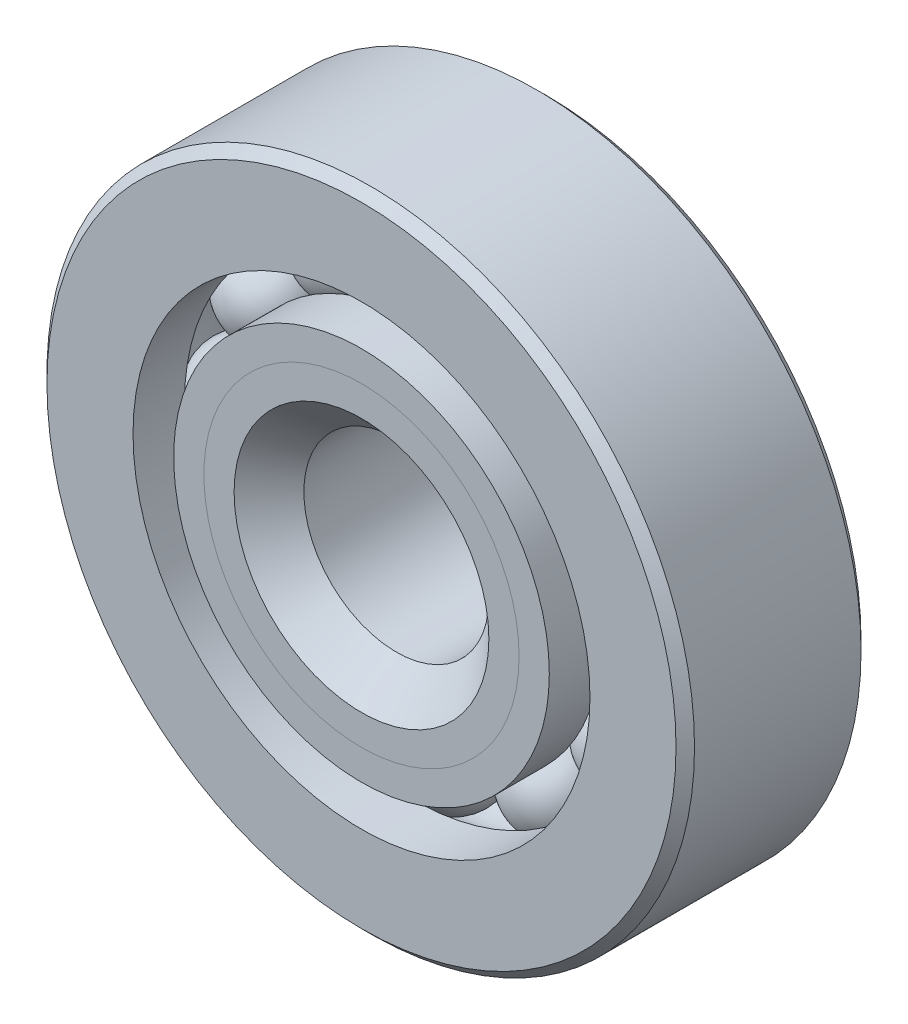
from build123d import *

# Parameters (mm, degrees)
CIRPATTERN1_COUNT = 12


with BuildPart() as part:
    # Sketch1 → Revolve1 (revolve)
    with BuildSketch(Plane(origin=(0, 0, 0), x_dir=(0, 0, -1), z_dir=(1, 0, 0)), mode=Mode.PRIVATE) as revolve1_sk:
        with BuildLine():
            Line((2.8575, 11.1125), (-2.8575, 11.1125))
            Line((-2.8575, 11.1125), (-3.175, 10.795))
            Line((-3.175, 10.795), (-3.175, 7.841552198))
            Line((-3.175, 7.841552198), (-1.411111111, 7.841552198))
            ThreePointArc((-1.411111111, 7.841552198), (0, 8.717968052), (1.411111111, 7.841552198))
            Line((1.411111111, 7.841552198), (3.175, 7.841552198))
            Line((3.175, 7.841552198), (3.175, 10.795))
            Line((3.175, 10.795), (2.8575, 11.1125))
        make_face()
    revolve(revolve1_sk.sketch.rotate(Axis((0, 0, 3.175), (0, 0, -1)), 90), axis=Axis((0, 0, 3.175), (0, 0, -1)))


with BuildPart() as body_2:
    # Sketch2 → Revolve2 (revolve)
    with BuildSketch(Plane(origin=(0, 0, 0), x_dir=(0, 0, -1), z_dir=(1, 0, 0)), mode=Mode.PRIVATE) as revolve2_sk:
        with BuildLine():
            Line((-3.175, 6.445947802), (-1.411111111, 6.445947802))
            ThreePointArc((-1.411111111, 6.445947802), (-0.830562959, 5.806466318), (0, 5.569531948))
            Line((0, 5.569531948), (0, 4.372265974))
            Line((0, 4.372265974), (-2.138159086, 4.372265974))
            Line((-2.138159086, 4.372265974), (-3.175, 5.409106888))
            Line((-3.175, 5.409106888), (-3.175, 6.445947802))
        make_face()
    revolve(revolve2_sk.sketch.rotate(Axis((0, 0, 3.175), (0, 0, -1)), 90), axis=Axis((0, 0, 3.175), (0, 0, -1)))


with BuildPart() as body_3:
    # Sketch3 → Revolve3 (revolve)
    with BuildSketch(Plane(origin=(0, 0, 0), x_dir=(0, 0, -1), z_dir=(1, 0, 0)), mode=Mode.PRIVATE) as revolve3_sk:
        with BuildLine():
            Line((-3.175, 5.409106888), (-2.138159086, 4.372265974))
            Line((-2.138159086, 4.372265974), (0, 4.372265974))
            Line((0, 4.372265974), (0, 5.569531948))
            ThreePointArc((0, 5.569531948), (0.830562959, 5.806466318), (1.411111111, 6.445947802))
            Line((1.411111111, 6.445947802), (3.175, 6.445947802))
            Line((3.175, 6.445947802), (3.175, 3.4925))
            Line((3.175, 3.4925), (2.8575, 3.175))
            Line((2.8575, 3.175), (-1.977734026, 3.175))
            Line((-1.977734026, 3.175), (-3.175, 4.372265974))
            Line((-3.175, 4.372265974), (-3.175, 5.409106888))
        make_face()
    revolve(revolve3_sk.sketch.rotate(Axis((0, 0, 3.175), (0, 0, -1)), 90), axis=Axis((0, 0, 3.175), (0, 0, -1)))


with BuildPart() as body_4:
    # Sketch4 → Revolve4 (revolve)
    with BuildSketch(Plane(origin=(0, 0, 0), x_dir=(0, 0, -1), z_dir=(1, 0, 0))):
        with BuildLine():
            Line((-1.574218052, 7.14375), (1.574218052, 7.14375))
            ThreePointArc((1.574218052, 7.14375), (0, 8.717968052), (-1.574218052, 7.14375))
        make_face()
    revolve(axis=Axis((0, 7.14375, 1.574218052), (0, 0, -1)))


with BuildPart() as cirpattern1_1:
    # CirPattern1: pattern copy
    add(body_4.part.rotate(Axis((0, 0, 0), (0, 0, 1)), 1 * 360 / CIRPATTERN1_COUNT))


with BuildPart() as cirpattern1_2:
    # CirPattern1: pattern copy
    add(body_4.part.rotate(Axis((0, 0, 0), (0, 0, 1)), 2 * 360 / CIRPATTERN1_COUNT))


with BuildPart() as cirpattern1_3:
    # CirPattern1: pattern copy
    add(body_4.part.rotate(Axis((0, 0, 0), (0, 0, 1)), 3 * 360 / CIRPATTERN1_COUNT))


with BuildPart() as cirpattern1_4:
    # CirPattern1: pattern copy
    add(body_4.part.rotate(Axis((0, 0, 0), (0, 0, 1)), 4 * 360 / CIRPATTERN1_COUNT))


with BuildPart() as cirpattern1_5:
    # CirPattern1: pattern copy
    add(body_4.part.rotate(Axis((0, 0, 0), (0, 0, 1)), 5 * 360 / CIRPATTERN1_COUNT))


with BuildPart() as cirpattern1_6:
    # CirPattern1: pattern copy
    add(body_4.part.rotate(Axis((0, 0, 0), (0, 0, 1)), 6 * 360 / CIRPATTERN1_COUNT))


with BuildPart() as cirpattern1_7:
    # CirPattern1: pattern copy
    add(body_4.part.rotate(Axis((0, 0, 0), (0, 0, 1)), 7 * 360 / CIRPATTERN1_COUNT))


with BuildPart() as cirpattern1_8:
    # CirPattern1: pattern copy
    add(body_4.part.rotate(Axis((0, 0, 0), (0, 0, 1)), 8 * 360 / CIRPATTERN1_COUNT))


with BuildPart() as cirpattern1_9:
    # CirPattern1: pattern copy
    add(body_4.part.rotate(Axis((0, 0, 0), (0, 0, 1)), 9 * 360 / CIRPATTERN1_COUNT))


with BuildPart() as cirpattern1_10:
    # CirPattern1: pattern copy
    add(body_4.part.rotate(Axis((0, 0, 0), (0, 0, 1)), 10 * 360 / CIRPATTERN1_COUNT))


with BuildPart() as cirpattern1_11:
    # CirPattern1: pattern copy
    add(body_4.part.rotate(Axis((0, 0, 0), (0, 0, 1)), 11 * 360 / CIRPATTERN1_COUNT))


solid = Compound([part.part, body_2.part, body_3.part, body_4.part, cirpattern1_1.part, cirpattern1_2.part, cirpattern1_3.part, cirpattern1_4.part, cirpattern1_5.part, cirpattern1_6.part, cirpattern1_7.part, cirpattern1_8.part, cirpattern1_9.part, cirpattern1_10.part, cirpattern1_11.part])
